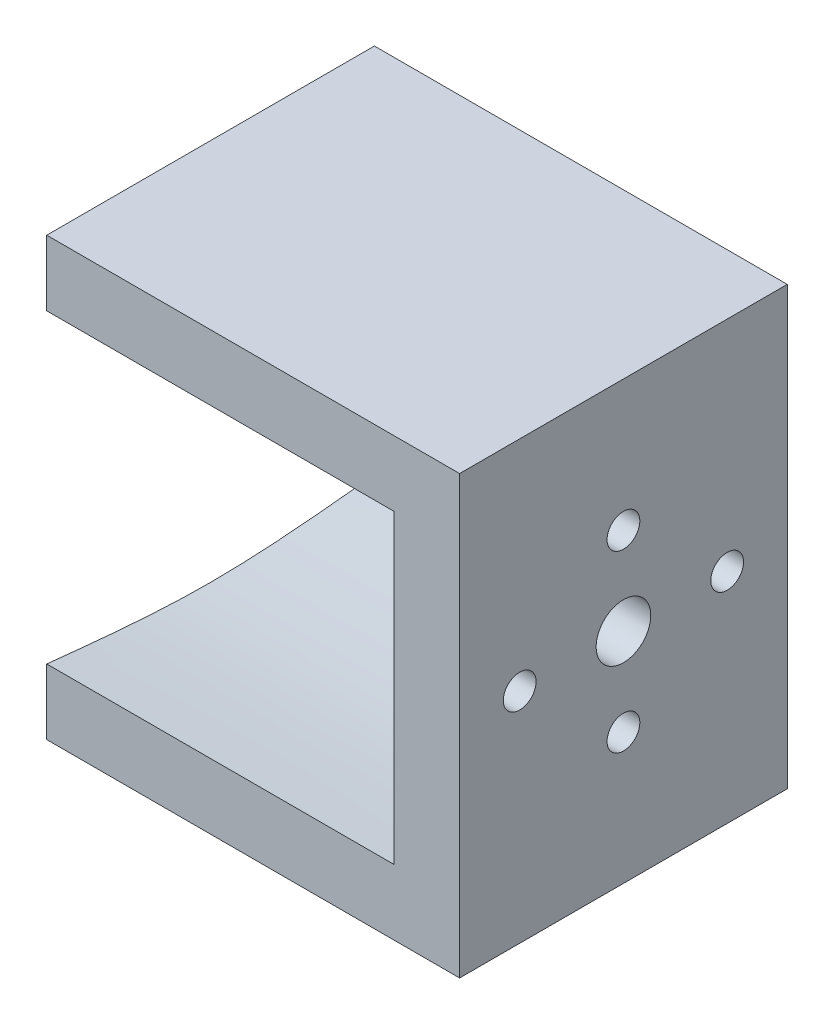
from build123d import *

# Parameters (mm, degrees)
BOSS_EXTRUDE1_DEPTH = 30
SKETCH4_R           = 1.5
SKETCH4_R_2         = 2.5
CUT_EXTRUDE1_DEPTH  = 49.076771644
CUT_EXTRUDE3_DEPTH  = 31.802137849


with BuildPart() as part:
    # Sketch2 → Boss-Extrude1 (new body)
    with BuildSketch(Plane.XY):
        Polygon((-18.901068924, 20), (-18.901068924, 14), (12.901068924, 14), (12.901068924, -14), (-18.901068924, -14), (-18.901068924, -20), (18.901068924, -20), (18.901068924, 20), align=None)
    extrude(amount=BOSS_EXTRUDE1_DEPTH)

    # Sketch4 → Cut-Extrude1 (cut, through all)
    with BuildSketch(Plane.ZY.offset(-12.901068924)):
        with Locations((15, 8)):
            Circle(SKETCH4_R)
        with Locations((15, 0)):
            Circle(SKETCH4_R_2)
        with Locations((15, -8)):
            Circle(SKETCH4_R)
        with Locations((5.5, 0)):
            Circle(SKETCH4_R)
        with Locations((24.5, 0)):
            Circle(SKETCH4_R)
    extrude(amount=-CUT_EXTRUDE1_DEPTH, mode=Mode.SUBTRACT)

    # Sketch7 → Cut-Extrude3 (cut)
    with BuildSketch(Plane.ZY.offset(18.901068924)):
        with BuildLine():
            Line((0, -14), (30, -14))
            add(Edge.make_bspline(
                [(0, -14), (5, -14.51661298), (15, -15.549838941), (25, -14.51661298), (30, -14)],
                knots=[0, 0, 0, 0, 0.5, 1, 1, 1, 1], degree=3))
        make_face()
        with BuildLine():
            Line((0, 14), (30, 14))
            add(Edge.make_bspline(
                [(0, 14), (5, 14.51661298), (15, 15.549838941), (25, 14.51661298), (30, 14)],
                knots=[0, 0, 0, 0, 0.5, 1, 1, 1, 1], degree=3))
        make_face()
    extrude(amount=-CUT_EXTRUDE3_DEPTH, mode=Mode.SUBTRACT)


solid = part.part
